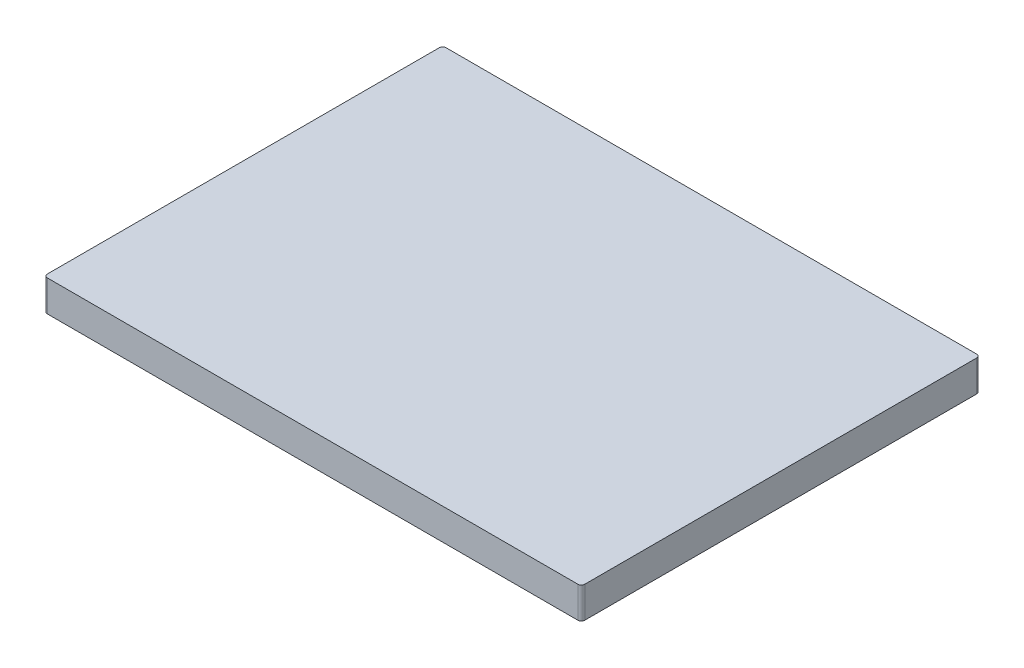
from build123d import *

# Parameters (mm, degrees)
SKETCH1_W           = 143
SKETCH1_H           = 101
BOSS_EXTRUDE1_DEPTH = 4
SKETCH2_W           = 155
SKETCH2_H           = 115
BOSS_EXTRUDE2_DEPTH = 4
FILLET1_R           = 5
FILLET2_R           = 1
SKETCH3_W           = 150
SKETCH3_H           = 110
BOSS_EXTRUDE3_DEPTH = 5


with BuildPart() as part:
    # Sketch1 → Boss-Extrude1 (new body)
    with BuildSketch(Plane(origin=(0, 0, 0), x_dir=(1, 0, 0), z_dir=(0, 1, 0))):
        Rectangle(SKETCH1_W, SKETCH1_H)
    extrude(amount=BOSS_EXTRUDE1_DEPTH)

    # Sketch2 → Boss-Extrude2 (add)
    with BuildSketch(Plane(origin=(0, 4, 0), x_dir=(1, 0, 0), z_dir=(0, 1, 0))):
        Rectangle(SKETCH2_W, SKETCH2_H)
    extrude(amount=BOSS_EXTRUDE2_DEPTH)

    # Fillet1
    fillet1_edges = [part.edges().sort_by_distance(p)[0] for p in [
        (71.5, 2, 50.5),
        (-71.5, 2, 50.5),
        (-71.5, 2, -50.5),
        (71.5, 2, -50.5),
    ]]
    fillet(fillet1_edges, radius=FILLET1_R)

    # Fillet2
    fillet2_edges = [part.edges().sort_by_distance(p)[0] for p in [
        (-77.5, 6, -57.5),
        (-77.5, 6, 57.5),
        (77.5, 6, 57.5),
        (77.5, 6, -57.5),
    ]]
    fillet(fillet2_edges, radius=FILLET2_R)

    # Sketch3 → Boss-Extrude3 (add)
    with BuildSketch(Plane(origin=(0, 4, 0), x_dir=(-1, 0, 0), z_dir=(0, -1, 0))):
        with BuildLine():
            Line((-76.5, -57.5), (76.5, -57.5))
            ThreePointArc((76.5, -57.5), (77.207106781, -57.207106781), (77.5, -56.5))
            Line((77.5, -56.5), (77.5, 56.5))
            ThreePointArc((77.5, 56.5), (77.207106781, 57.207106781), (76.5, 57.5))
            Line((76.5, 57.5), (-76.5, 57.5))
            ThreePointArc((-76.5, 57.5), (-77.207106781, 57.207106781), (-77.5, 56.5))
            Line((-77.5, 56.5), (-77.5, -56.5))
            ThreePointArc((-77.5, -56.5), (-77.207106781, -57.207106781), (-76.5, -57.5))
        make_face()
        Rectangle(SKETCH3_W, SKETCH3_H, mode=Mode.SUBTRACT)
    extrude(amount=BOSS_EXTRUDE3_DEPTH)


solid = part.part
